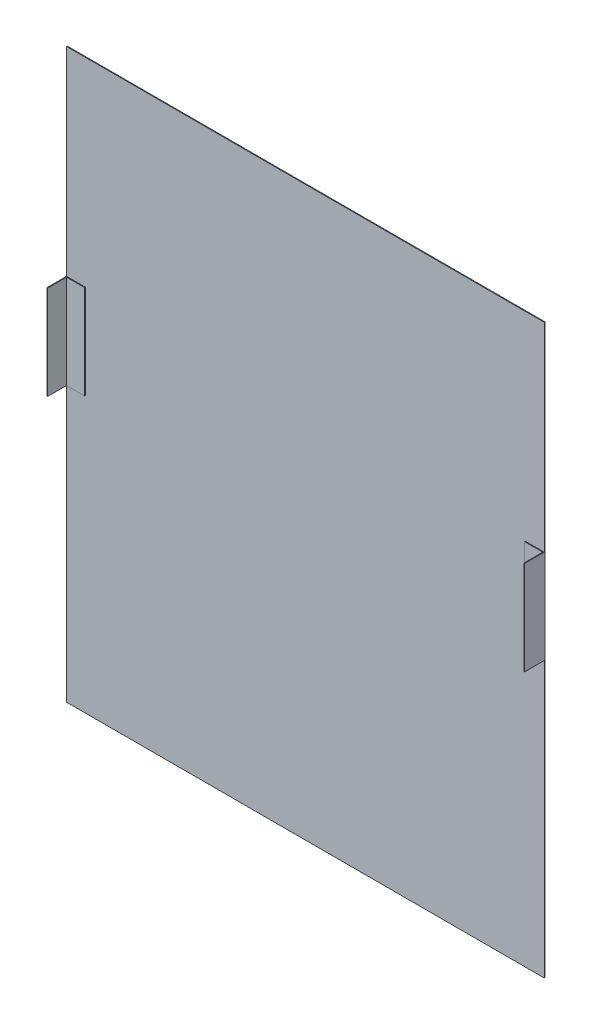
from build123d import *

# Parameters (mm, degrees)
SKETCH1_W           = 509
SKETCH1_H           = 605
BOSS_EXTRUDE1_DEPTH = 0.8
SKETCH2_W           = 20
SKETCH2_H           = 100
BOSS_EXTRUDE2_DEPTH = 0.8
SKETCH4_W           = 20
SKETCH4_H           = 100
BOSS_EXTRUDE3_DEPTH = 0.8
SKETCH5_W           = 20
SKETCH5_H           = 100
BOSS_EXTRUDE4_DEPTH = 0.8


with BuildPart() as part:
    # Sketch1 → Boss-Extrude1 (new body)
    with BuildSketch(Plane.XY):
        with Locations((254.5, 302.5)):
            Rectangle(SKETCH1_W, SKETCH1_H)
    extrude(amount=BOSS_EXTRUDE1_DEPTH)

    # Sketch2 → Boss-Extrude2 (add)
    with BuildSketch(Plane.XY.offset(0.8)):
        with Locations((10, 342.918789735)):
            Rectangle(SKETCH2_W, SKETCH2_H)
        with Locations((499, 342.918789735)):
            Rectangle(SKETCH2_W, SKETCH2_H)
    extrude(amount=BOSS_EXTRUDE2_DEPTH)

    # Sketch4 → Boss-Extrude3 (add)
    with BuildSketch(Plane.ZY):
        with Locations((11.6, 342.918789735)):
            Rectangle(SKETCH4_W, SKETCH4_H)
    extrude(amount=-BOSS_EXTRUDE3_DEPTH)

    # Sketch5 → Boss-Extrude4 (add)
    with BuildSketch(Plane(origin=(509, 0, 0), x_dir=(0, 0, -1), z_dir=(1, 0, 0))):
        with Locations((-11.6, 342.918789735)):
            Rectangle(SKETCH5_W, SKETCH5_H)
    extrude(amount=-BOSS_EXTRUDE4_DEPTH)


solid = part.part
